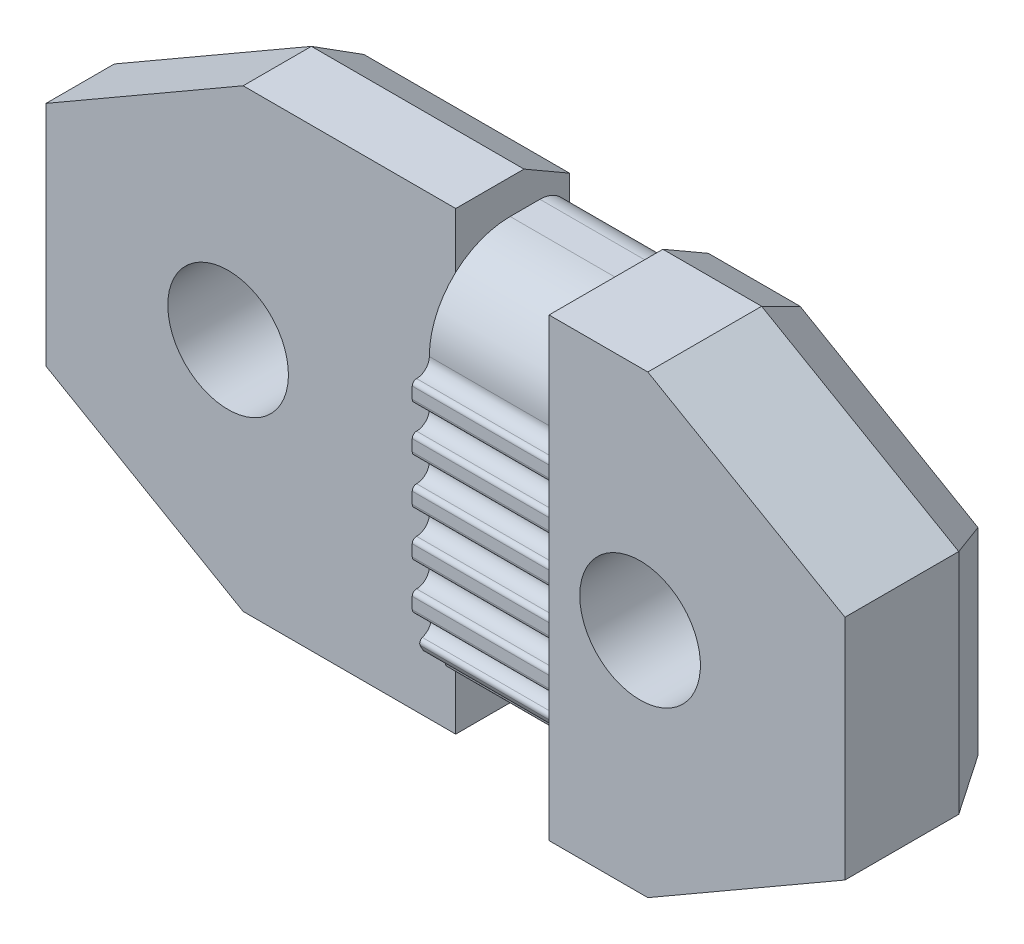
from build123d import *
from OCP.BRepFilletAPI import BRepFilletAPI_MakeChamfer

# Parameters (mm, degrees)
AUFSATZ_LINEAR_AUSTRAGEN1_DEPTH    = 6.1
SKIZZE1_W                          = 6
SKIZZE1_H                          = 15
AUFSATZ_LINEAR_AUSTRAGEN1_2_DEPTH  = 6.1
SKIZZE2_W                          = 6
SKIZZE2_H                          = 15
SCHNITT_LINEAR_AUSTRAGEN1_DEPTH    = 6.1
SKIZZE3_R                          = 2.65
AUFSATZ_LINEAR_AUSTRAGEN2_DEPTH    = 2.19
SCHNITT_LINEAR_AUSTRAGEN7_DEPTH    = 6.1
AUFSATZ_LINEAR_START               = 4.81
SKIZZE4_R                          = 2.65
AUFSATZ_LINEAR_AUSTRAGEN3_DEPTH    = 4.81
SKIZZE5_R                          = 2.65
AUFSATZ_LINEAR_AUSTRAGEN4_DEPTH    = 0.19
FASE1_SIZE                         = 5
FASE1_SIZE2                        = 8.660254038
FASE2_SIZE                         = 2
FASE2_SIZE2                        = 1.154700538
SCHNITT_LINEAR_START               = -14
SCHNITT_LINEAR_AUSTRAGEN8_DEPTH    = 2
SCHNITT_LINEAR_START_2             = -13.5
SCHNITT_LINEAR_AUSTRAGEN5_DEPTH    = 2.5
VERRUNDUNG1_R                      = 1.3
SCHNITT_LINEAR_AUSTRAGEN9_DEPTH    = 6.1
K_RPER_VERSCHIEBEN_KOPIEREN1_ANGLE = 90


with BuildPart() as part:
    # Skizze1 → Aufsatz-Linear austragen1 (new body)
    with BuildSketch(Plane.XY):
        with BuildLine():
            Line((-7.050000002, 7.568775844), (-7.050000002, 8.068775844))
            ThreePointArc((-7.050000002, 8.068775844), (-7.105649713, 8.203126132), (-7.240000002, 8.258775844))
            ThreePointArc((-7.240000002, 8.258775844), (-7.800000002, 8.818775844), (-7.240000002, 9.378775844))
            ThreePointArc((-7.240000002, 9.378775844), (-7.105649713, 9.434425555), (-7.050000002, 9.568775844))
            Line((-7.050000002, 9.568775844), (-7.050000002, 10.068775844))
            ThreePointArc((-7.050000002, 10.068775844), (-7.105649713, 10.203126132), (-7.240000002, 10.258775844))
            ThreePointArc((-7.240000002, 10.258775844), (-7.800000002, 10.818775844), (-7.240000002, 11.378775844))
            ThreePointArc((-7.240000002, 11.378775844), (-7.105649713, 11.434425555), (-7.050000002, 11.568775844))
            Line((-7.050000002, 11.568775844), (-7.050000002, 12.068775844))
            ThreePointArc((-7.050000002, 12.068775844), (-7.105649713, 12.203126132), (-7.240000002, 12.258775843))
            Line((-7.240000002, 12.258775843), (-9.150000002, 12.258775843))
            Line((-9.150000002, 12.258775843), (-9.150000002, 4))
            Line((-9.150000002, 4), (-10.615000002, 4))
            Line((-10.615000002, 4), (-13.960000002, 4))
            Line((-13.960000002, 4), (-13.960000002, 0.75))
            Line((-13.960000002, 0.75), (-11.613821225, 0.75))
            ThreePointArc((-11.613821225, 0.75), (-11.217841428, 0.585979797), (-11.053821225, 0.19))
            ThreePointArc((-11.053821225, 0.19), (-10.998171513, 0.055649712), (-10.863821225, 0))
            Line((-10.863821225, 0), (-10.615000002, 0))
            ThreePointArc((-10.615000002, 0), (-10.474650873, 0.002763747), (-10.334519354, 0.011050703))
            ThreePointArc((-10.334519354, 0.011050703), (-10.203241743, 0.079144265), (-10.160552613, 0.22073587))
            ThreePointArc((-10.160552613, 0.22073587), (-9.779942741, 0.876709768), (-9.094653704, 0.551833537))
            ThreePointArc((-9.094653704, 0.551833537), (-8.979253962, 0.459348706), (-8.832500002, 0.477619436))
            ThreePointArc((-8.832500002, 0.477619436), (-8.712335964, 0.550187475), (-8.595121987, 0.627429949))
            ThreePointArc((-8.595121987, 0.627429949), (-8.515479022, 0.752039509), (-8.549304953, 0.896006001))
            ThreePointArc((-8.549304953, 0.896006001), (-8.547674084, 1.654400997), (-7.791758254, 1.715694446))
            ThreePointArc((-7.791758254, 1.715694446), (-7.64557673, 1.693300104), (-7.527619437, 1.7825))
            ThreePointArc((-7.527619437, 1.7825), (-7.459838348, 1.905427785), (-7.396949303, 2.030928718))
            ThreePointArc((-7.396949303, 2.030928718), (-7.390281252, 2.178665245), (-7.491558614, 2.286430919))
            ThreePointArc((-7.491558614, 2.286430919), (-7.869343738, 2.944035686), (-7.24534815, 3.375075285))
            ThreePointArc((-7.24534815, 3.375075285), (-7.107554066, 3.428771978), (-7.050000002, 3.565))
            Line((-7.050000002, 3.565), (-7.050000002, 4.068775844))
            ThreePointArc((-7.050000002, 4.068775844), (-7.105649713, 4.203126132), (-7.240000002, 4.258775844))
            ThreePointArc((-7.240000002, 4.258775844), (-7.800000002, 4.818775844), (-7.240000002, 5.378775844))
            ThreePointArc((-7.240000002, 5.378775844), (-7.105649713, 5.434425555), (-7.050000002, 5.568775844))
            Line((-7.050000002, 5.568775844), (-7.050000002, 6.068775844))
            ThreePointArc((-7.050000002, 6.068775844), (-7.105649713, 6.203126132), (-7.240000002, 6.258775844))
            ThreePointArc((-7.240000002, 6.258775844), (-7.800000002, 6.818775844), (-7.240000002, 7.378775844))
            ThreePointArc((-7.240000002, 7.378775844), (-7.105649713, 7.434425555), (-7.050000002, 7.568775844))
        make_face()
    extrude(amount=AUFSATZ_LINEAR_AUSTRAGEN1_DEPTH)

    # Skizze3 → Aufsatz-Linear austragen2 (add)
    with BuildSketch(Plane.ZY.offset(9.150000002)):
        Polygon((6.1, 12.258775843), (6.1, 16.37), (0, 16.37), (0, 17.87), (-13, 17.87), (-13, -2.13), (0, -2.13), (0, 12.258775843), align=None)
        with Locations((-4, 7.87)):
            Circle(SKIZZE3_R, mode=Mode.SUBTRACT)
    extrude(amount=-AUFSATZ_LINEAR_AUSTRAGEN2_DEPTH)

    # Skizze15 → Schnitt-Linear austragen7 (cut)
    with BuildSketch(Plane.XY.offset(6.1)):
        with BuildLine():
            Line((-7.800000002, 12.818775843), (-7.800000002, 15.07))
            ThreePointArc((-7.800000002, 15.07), (-8.180761186, 15.989238816), (-9.100000002, 16.37))
            Line((-9.100000002, 16.37), (-6.960000002, 16.37))
            Line((-6.960000002, 16.37), (-6.960000002, 12.258775843))
            Line((-6.960000002, 12.258775843), (-7.240000002, 12.258775843))
            ThreePointArc((-7.240000002, 12.258775843), (-7.635979799, 12.422796046), (-7.800000002, 12.818775843))
        make_face()
    extrude(amount=-SCHNITT_LINEAR_AUSTRAGEN7_DEPTH, mode=Mode.SUBTRACT)

    # Skizze4 → Aufsatz-Linear austragen3 (add)
    with BuildSketch(Plane.ZY.offset(9.150000002).offset(AUFSATZ_LINEAR_START)):
        Polygon((6.1, 17.87), (6.1, 16.37), (0, 16.37), (0, 17.87), (-13, 17.87), (-13, -2.13), (0, -2.13), (0, 4), (6.1, 4), (6.1, -2.13), (24.1, -2.13), (24.1, 17.87), align=None)
        with Locations(Location((16.1, 7.87, 0), (0, 0, 90))):
            Circle(SKIZZE4_R, mode=Mode.SUBTRACT)
        with Locations((-4, 7.87)):
            Circle(SKIZZE4_R, mode=Mode.SUBTRACT)
    extrude(amount=-AUFSATZ_LINEAR_AUSTRAGEN3_DEPTH)

    # Skizze5 → Aufsatz-Linear austragen4 (add)
    with BuildSketch(Plane(origin=(-9.150000002, 0, 0), x_dir=(0, 0, -1), z_dir=(1, 0, 0))):
        Polygon((-6.1, 17.87), (-24.1, 17.87), (-24.1, -2.13), (-6.1, -2.13), (-6.1, 0.655715781), (-6.1, 16.37), align=None)
        with Locations(Location((-16.1, 7.87, 0), (0, 0, 90))):
            Circle(SKIZZE5_R, mode=Mode.SUBTRACT)
    extrude(amount=AUFSATZ_LINEAR_AUSTRAGEN4_DEPTH)

    # Fase1: one chamfer whose edges measure the first distance from different faces: ONE call of the kernel's chamfer builder (chamfer() names one face for all edges)
    fase1_edges_1 = [part.edges().sort_by_distance(p)[0] for p in [
        (-10.460000002, -2.13, -13),
        (-10.460000002, 17.87, -13),
    ]]
    fase1_side_1 = [part.faces().sort_by_distance(p)[0] for p in [
        (-10.460000002, 7.87, -13),
    ]]
    fase1_edges_2 = [part.edges().sort_by_distance(p)[0] for p in [
        (-11.460000002, 17.87, 24.1),
        (-11.460000002, -2.13, 24.1),
    ]]
    fase1_side_2 = [part.faces().sort_by_distance(p)[0] for p in [
        (-11.460000002, 7.87, 24.1),
    ]]
    fase1 = BRepFilletAPI_MakeChamfer(part.part.solid().wrapped)
    for e in fase1_edges_1:
        fase1.Add(FASE1_SIZE, FASE1_SIZE2, e.wrapped, fase1_side_1[0].wrapped)  # the first distance lies on this face
    for e in fase1_edges_2:
        fase1.Add(FASE1_SIZE, FASE1_SIZE2, e.wrapped, fase1_side_2[0].wrapped)  # the first distance lies on this face
    add(Compound.cast(fase1.Shape()), mode=Mode.REPLACE)

    # Fase2: one chamfer whose edges measure the first distance from different faces: ONE call of the kernel's chamfer builder (chamfer() names one face for all edges)
    fase2_edges_1 = [part.edges().sort_by_distance(p)[0] for p in [
        (-13.960000002, 17.87, 10.769872981),
    ]]
    fase2_side_1 = [part.faces().sort_by_distance(p)[0] for p in [
        (-11.460000002, 17.87, 10.769872981),
    ]]
    fase2_edges_2 = [part.edges().sort_by_distance(p)[0] for p in [
        (-13.960000002, 17.87, -2.169872981),
    ]]
    fase2_side_2 = [part.faces().sort_by_distance(p)[0] for p in [
        (-10.460000002, 17.87, -2.169872981),
    ]]
    fase2_edges_3 = [part.edges().sort_by_distance(p)[0] for p in [
        (-13.960000002, -2.13, 10.769872981),
    ]]
    fase2_side_3 = [part.faces().sort_by_distance(p)[0] for p in [
        (-11.460000002, -2.13, 10.769872981),
    ]]
    fase2_edges_4 = [part.edges().sort_by_distance(p)[0] for p in [
        (-13.960000002, 7.87, 24.1),
    ]]
    fase2_side_4 = [part.faces().sort_by_distance(p)[0] for p in [
        (-11.460000002, 7.87, 24.1),
    ]]
    fase2_edges_5 = [part.edges().sort_by_distance(p)[0] for p in [
        (-13.960000002, 7.87, -13),
    ]]
    fase2_side_5 = [part.faces().sort_by_distance(p)[0] for p in [
        (-10.460000002, 7.87, -13),
    ]]
    fase2_edges_6 = [part.edges().sort_by_distance(p)[0] for p in [
        (-13.960000002, -2.13, -2.169872981),
    ]]
    fase2_side_6 = [part.faces().sort_by_distance(p)[0] for p in [
        (-10.460000002, -2.13, -2.169872981),
    ]]
    fase2_edges_7 = [part.edges().sort_by_distance(p)[0] for p in [
        (-13.960000002, 0.37, -8.669872981),
    ]]
    fase2_side_7 = [part.faces().sort_by_distance(p)[0] for p in [
        (-10.460000002, 0.37, -8.669872981),
    ]]
    fase2_edges_8 = [part.edges().sort_by_distance(p)[0] for p in [
        (-13.960000002, 0.37, 19.769872981),
    ]]
    fase2_side_8 = [part.faces().sort_by_distance(p)[0] for p in [
        (-11.460000002, 0.37, 19.769872981),
    ]]
    fase2_edges_9 = [part.edges().sort_by_distance(p)[0] for p in [
        (-13.960000002, 15.37, -8.669872981),
    ]]
    fase2_side_9 = [part.faces().sort_by_distance(p)[0] for p in [
        (-10.460000002, 15.37, -8.669872981),
    ]]
    fase2_edges_10 = [part.edges().sort_by_distance(p)[0] for p in [
        (-13.960000002, 15.37, 19.769872981),
    ]]
    fase2_side_10 = [part.faces().sort_by_distance(p)[0] for p in [
        (-11.460000002, 15.37, 19.769872981),
    ]]
    fase2 = BRepFilletAPI_MakeChamfer(part.part.solid().wrapped)
    for e in fase2_edges_1:
        fase2.Add(FASE2_SIZE, FASE2_SIZE2, e.wrapped, fase2_side_1[0].wrapped)  # the first distance lies on this face
    for e in fase2_edges_2:
        fase2.Add(FASE2_SIZE, FASE2_SIZE2, e.wrapped, fase2_side_2[0].wrapped)  # the first distance lies on this face
    for e in fase2_edges_3:
        fase2.Add(FASE2_SIZE, FASE2_SIZE2, e.wrapped, fase2_side_3[0].wrapped)  # the first distance lies on this face
    for e in fase2_edges_4:
        fase2.Add(FASE2_SIZE, FASE2_SIZE2, e.wrapped, fase2_side_4[0].wrapped)  # the first distance lies on this face
    for e in fase2_edges_5:
        fase2.Add(FASE2_SIZE, FASE2_SIZE2, e.wrapped, fase2_side_5[0].wrapped)  # the first distance lies on this face
    for e in fase2_edges_6:
        fase2.Add(FASE2_SIZE, FASE2_SIZE2, e.wrapped, fase2_side_6[0].wrapped)  # the first distance lies on this face
    for e in fase2_edges_7:
        fase2.Add(FASE2_SIZE, FASE2_SIZE2, e.wrapped, fase2_side_7[0].wrapped)  # the first distance lies on this face
    for e in fase2_edges_8:
        fase2.Add(FASE2_SIZE, FASE2_SIZE2, e.wrapped, fase2_side_8[0].wrapped)  # the first distance lies on this face
    for e in fase2_edges_9:
        fase2.Add(FASE2_SIZE, FASE2_SIZE2, e.wrapped, fase2_side_9[0].wrapped)  # the first distance lies on this face
    for e in fase2_edges_10:
        fase2.Add(FASE2_SIZE, FASE2_SIZE2, e.wrapped, fase2_side_10[0].wrapped)  # the first distance lies on this face
    add(Compound.cast(fase2.Shape()), mode=Mode.REPLACE)

    # Skizze11 → Schnitt-Linear austragen8 (cut)
    with BuildSketch(Plane.XZ.offset(2.13).offset(SCHNITT_LINEAR_START)):
        with BuildLine():
            Line((-13.960000002, 7.6), (-13.960000002, 6.1))
            ThreePointArc((-13.960000002, 6.1), (-12.89933983, 5.660660172), (-12.460000002, 4.6))
            Line((-12.460000002, 4.6), (-12.460000002, 1.5))
            ThreePointArc((-12.460000002, 1.5), (-12.89933983, 0.439339828), (-13.960000002, 0))
            Line((-13.960000002, 0), (-13.960000002, -1.5))
            ThreePointArc((-13.960000002, -1.5), (-11.838679658, -0.621320344), (-10.960000002, 1.5))
            Line((-10.960000002, 1.5), (-10.960000002, 4.6))
            ThreePointArc((-10.960000002, 4.6), (-11.838679658, 6.721320344), (-13.960000002, 7.6))
        make_face()
    extrude(amount=-SCHNITT_LINEAR_AUSTRAGEN8_DEPTH, mode=Mode.SUBTRACT)

    # Skizze13 → Schnitt-Linear austragen5 (cut)
    with BuildSketch(Plane.XY.offset(24.1).offset(SCHNITT_LINEAR_START_2)):
        with BuildLine():
            Line((-12.960000002, 5.87), (-12.960000002, 9.87))
            ThreePointArc((-12.960000002, 9.87), (-13.252893221, 10.577106781), (-13.960000002, 10.87))
            Line((-13.960000002, 10.87), (-13.960000002, 12.37))
            ThreePointArc((-13.960000002, 12.37), (-12.192233049, 11.637766953), (-11.460000002, 9.87))
            Line((-11.460000002, 9.87), (-11.460000002, 5.87))
            ThreePointArc((-11.460000002, 5.87), (-12.192233049, 4.102233047), (-13.960000002, 3.37))
            Line((-13.960000002, 3.37), (-13.960000002, 4.87))
            ThreePointArc((-13.960000002, 4.87), (-13.252893221, 5.162893219), (-12.960000002, 5.87))
        make_face()
    extrude(amount=-SCHNITT_LINEAR_AUSTRAGEN5_DEPTH, mode=Mode.SUBTRACT)

    # Verrundung1
    verrundung1_edges = [part.edges().sort_by_distance(p)[0] for p in [
        (-13.960000002, 16.37, 3.05),
    ]]
    fillet(verrundung1_edges, radius=VERRUNDUNG1_R)

    # Skizze16 → Schnitt-Linear austragen9 (cut)
    with BuildSketch(Plane.XY.offset(6.1)):
        with BuildLine():
            Line((-7.800000002, 12.818775843), (-7.800000002, 15.07))
            ThreePointArc((-7.800000002, 15.07), (-8.132529072, 15.938331734), (-8.960000002, 16.362439554))
            Line((-8.960000002, 16.362439554), (-8.960000002, 15.4442739))
            ThreePointArc((-8.960000002, 15.4442739), (-8.102919524, 14.253944827), (-7.800000002, 12.818775843))
        make_face()
        with BuildLine():
            Line((-8.960000002, 15.4442739), (-8.960000002, 16.362439554))
            ThreePointArc((-8.960000002, 16.362439554), (-9.029898004, 16.368108512), (-9.100000002, 16.37))
            Line((-9.100000002, 16.37), (-11.351224158, 16.37))
            ThreePointArc((-11.351224158, 16.37), (-10.069143644, 16.130491798), (-8.960000002, 15.4442739))
        make_face()
    extrude(amount=-SCHNITT_LINEAR_AUSTRAGEN9_DEPTH, mode=Mode.SUBTRACT)


with BuildPart() as body_2:
    # Skizze1 → Aufsatz-Linear austragen1 2 (new body)
    with BuildSketch(Plane.XY):
        with Locations((-3, 7.5)):
            Rectangle(SKIZZE1_W, SKIZZE1_H)
    extrude(amount=AUFSATZ_LINEAR_AUSTRAGEN1_2_DEPTH)

    # Skizze2 → Schnitt-Linear austragen1 (cut)
    with BuildSketch(Plane.XY.offset(6.1)):
        with Locations((-3, 7.5)):
            Rectangle(SKIZZE2_W, SKIZZE2_H)
    extrude(amount=-SCHNITT_LINEAR_AUSTRAGEN1_DEPTH, mode=Mode.SUBTRACT)


with BuildPart() as part_1:
    # Körper-Verschieben/Kopieren1: moved
    add(part.part.rotate(Axis((-10.55, 0, 5.55), (0, -1, 0)), K_RPER_VERSCHIEBEN_KOPIEREN1_ANGLE))


solid = part_1.part
